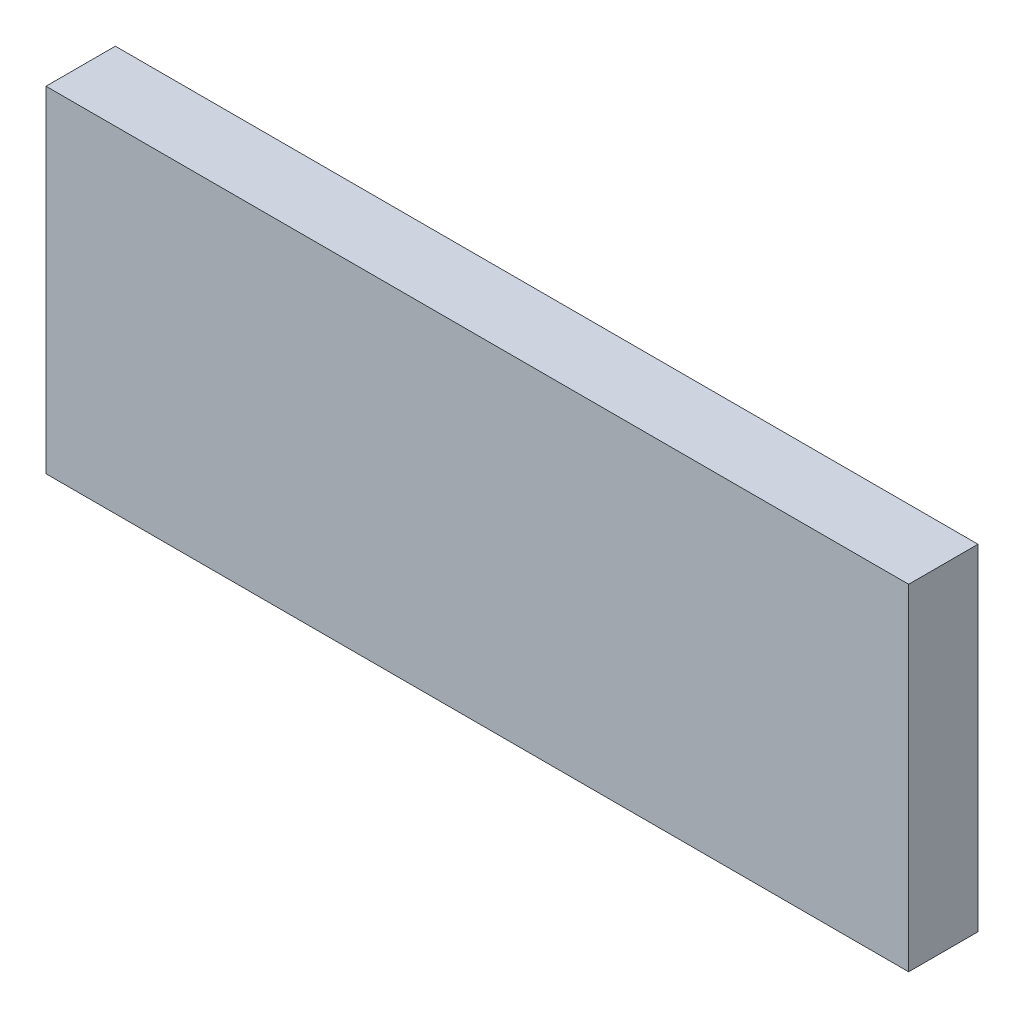
from build123d import *

# Parameters (mm, degrees)
SKETCH1_W           = 78.994
SKETCH1_H           = 30.734
BOSS_EXTRUDE1_DEPTH = 6.35


with BuildPart() as part:
    # Sketch1 → Boss-Extrude1 (new body)
    with BuildSketch(Plane.XY):
        with Locations((39.497, 15.367)):
            Rectangle(SKETCH1_W, SKETCH1_H)
    extrude(amount=BOSS_EXTRUDE1_DEPTH)


solid = part.part
